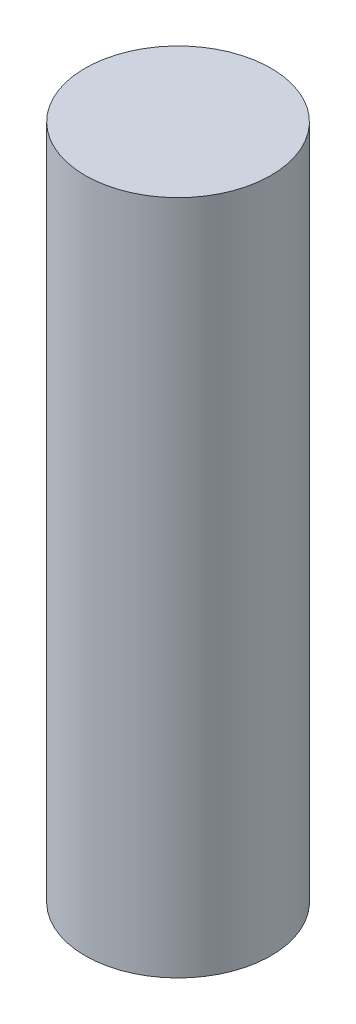
from build123d import *

# Parameters (mm, degrees)
SKETCH1_R           = 13.75
BOSS_EXTRUDE1_DEPTH = 100


with BuildPart() as part:
    # Sketch1 → Boss-Extrude1 (new body)
    with BuildSketch(Plane(origin=(0, 0, 0), x_dir=(1, 0, 0), z_dir=(0, 1, 0))):
        with Locations(Location((0, 0, 0), (0, 0, 270))):
            Circle(SKETCH1_R)
    extrude(amount=BOSS_EXTRUDE1_DEPTH)


solid = part.part
